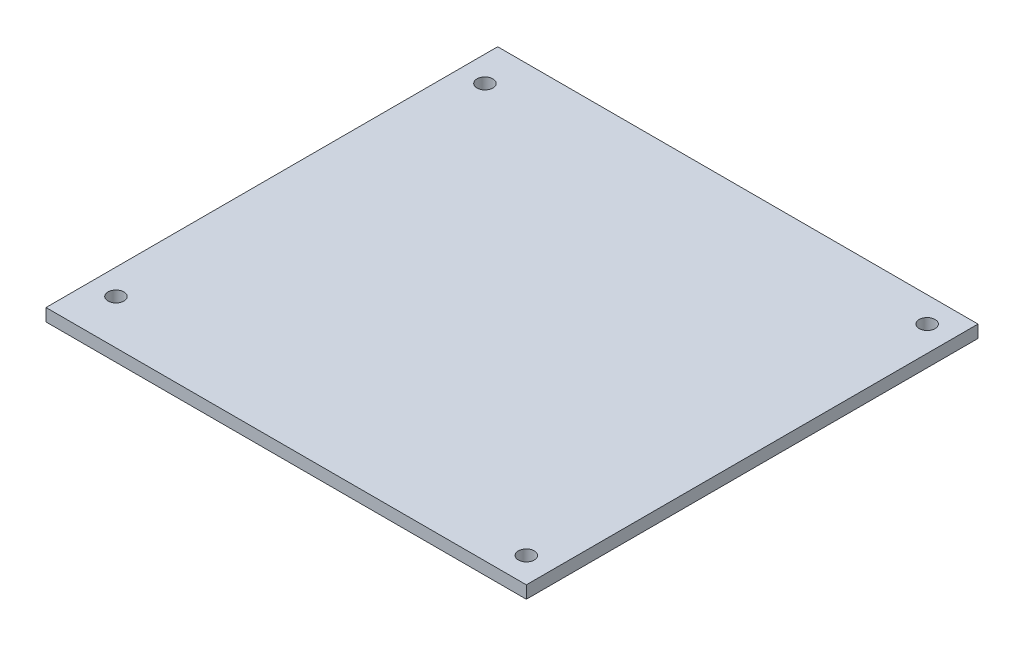
from build123d import *

# Parameters (mm, degrees)
SKETCH1_W             = 95.89
SKETCH1_H             = 90.17
BOSS_EXTRUDE1_DEPTH   = 2.5
F_1_0MM_DOWEL_HOLE1_D = 3.18


with BuildPart() as part:
    # Sketch1 → Boss-Extrude1 (new body)
    with BuildSketch(Plane(origin=(0, 0, 0), x_dir=(1, 0, 0), z_dir=(0, 1, 0))):
        with Locations((47.945, 45.085)):
            Rectangle(SKETCH1_W, SKETCH1_H)
    extrude(amount=BOSS_EXTRUDE1_DEPTH)

    # Ø1.0mm Dowel Hole1 (through all)
    with Locations(Plane(origin=(5.08, 2.5, -82.55), x_dir=(0, 0, 1), z_dir=(0, 1, 0))):
        with Locations((0, 0), (73.66, 0), (-2.54, 85.73), (77.47, 85.73)):
            Hole(F_1_0MM_DOWEL_HOLE1_D / 2)


solid = part.part
